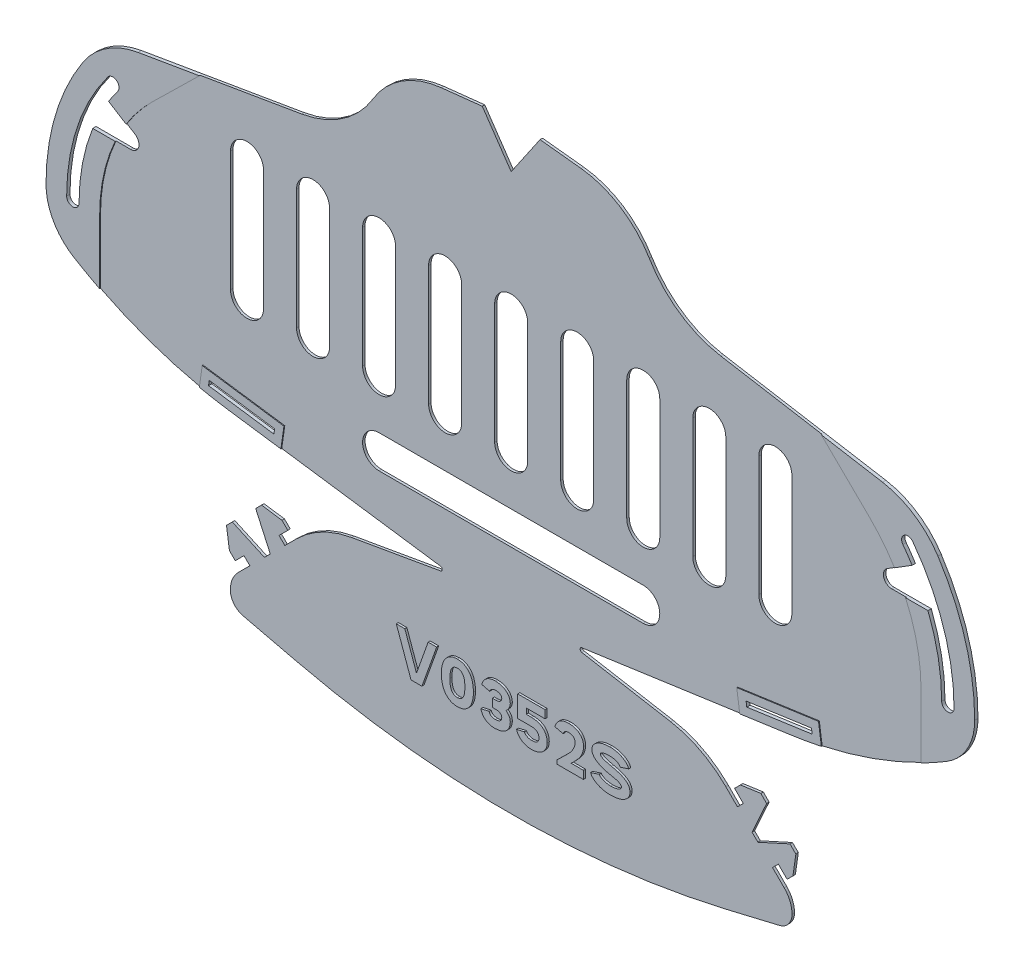
from build123d import *

# Parameters (mm, degrees)
MAIN_SHAPE_DEPTH                   = 0.6
ELASTIC_ATTACHMENT_POINTS_DEPTH    = 184.525502315
REINFORCED_ATTACHMENT_POINTS_DEPTH = 0.2
TAB_SLITS_DEPTH                    = 184.525502315
REINFORCED_TAB_SLITS_DEPTH         = 0.2
TAB_FLEX_RELIEF_DEPTH              = 184.525502315
TAB_FLEX_RELIEF_DEPTH_BACK         = 184.525502315
BREATHING_SLITS_DEPTH              = 184.525502315
VERSION_NUMBER_DEPTH               = 0.5
FILLET1_R                          = 0.5
CUT_EXTRUDE1_DEPTH                 = 184.526265229
CUT_EXTRUDE1_DEPTH_BACK            = 184.526265229


with BuildPart() as part:
    # Sketch1 → Main Shape (new body)
    with BuildSketch(Plane.XY):
        with BuildLine():
            Line((0, -10.235233266), (-7, 0))
            Line((-7, 0), (-16.941855461, -1.076805455))
            ThreePointArc((-16.941855461, -1.076805455), (-26.448172688, -4.42923559), (-33.461443341, -11.669600897))
            ThreePointArc((-33.461443341, -11.669600897), (-40.804108255, -19.481824954), (-50.74391922, -23.5))
            Line((-50.74391922, -23.5), (-90.180351554, -30.190874742))
            ThreePointArc((-90.180351554, -30.190874742), (-97.811505455, -33.190405434), (-103.597722286, -39))
            ThreePointArc((-103.597722286, -39), (-110.227482046, -53.35351039), (-112.5, -69))
            ThreePointArc((-112.5, -69), (-110.685143325, -75.893640703), (-105.711102551, -81))
            ThreePointArc((-105.711102551, -81), (-87.655491519, -89.524485559), (-68.266232563, -94.291935705))
            Line((-68.266232563, -94.291935705), (-14, -102))
            Line((-14, -102), (-38.626554922, -106.304973016))
            ThreePointArc((-38.626554922, -106.304973016), (-45.849449199, -108.748014338), (-52, -113.254607005))
            Line((-52, -113.254607005), (-54.828307349, -116.0831539))
            Line((-54.828307349, -116.0831539), (-56.242580797, -114.669000226))
            Line((-56.242580797, -114.669000226), (-54.121350285, -112.547590054))
            Line((-54.121350285, -112.547590054), (-55.535623732, -111.13343638))
            Line((-55.535623732, -111.13343638), (-60.48540114, -110.426539202))
            Line((-60.48540114, -110.426539202), (-68.970323187, -118.912179887))
            Line((-68.970323187, -118.912179887), (-68.263006804, -123.861897408))
            Line((-68.263006804, -123.861897408), (-66.848733357, -125.276051082))
            Line((-66.848733357, -125.276051082), (-64.727502845, -123.154640911))
            Line((-64.727502845, -123.154640911), (-63.313229397, -124.568794586))
            Line((-63.313229397, -124.568794586), (-66.141536747, -127.397341481))
            ThreePointArc((-66.141536747, -127.397341481), (-67.550417669, -129.506025763), (-68.045148042, -131.993340924))
            ThreePointArc((-68.045148042, -131.993340924), (-67.183295285, -134.473669911), (-64.9691321, -135.885159709))
            Line((-64.9691321, -135.885159709), (-52.436095294, -138.860716087))
            ThreePointArc((-52.436095294, -138.860716087), (-26.397134772, -143.459954927), (0, -145))
            ThreePointArc((0, -145), (26.397134772, -143.459954927), (52.436095294, -138.860716087))
            Line((52.436095294, -138.860716087), (64.9691321, -135.885159709))
            ThreePointArc((64.9691321, -135.885159709), (67.183295285, -134.473669911), (68.045148042, -131.993340924))
            ThreePointArc((68.045148042, -131.993340924), (67.550417669, -129.506025763), (66.141536747, -127.397341481))
            Line((66.141536747, -127.397341481), (63.313229397, -124.568794586))
            Line((63.313229397, -124.568794586), (64.727502845, -123.154640911))
            Line((64.727502845, -123.154640911), (66.848733357, -125.276051082))
            Line((66.848733357, -125.276051082), (68.263006804, -123.861897408))
            Line((68.263006804, -123.861897408), (68.970323187, -118.912179887))
            Line((68.970323187, -118.912179887), (60.48540114, -110.426539202))
            Line((60.48540114, -110.426539202), (55.535623732, -111.13343638))
            Line((55.535623732, -111.13343638), (54.121350285, -112.547590054))
            Line((54.121350285, -112.547590054), (56.242580797, -114.669000226))
            Line((56.242580797, -114.669000226), (54.828307349, -116.0831539))
            Line((54.828307349, -116.0831539), (52, -113.254607005))
            ThreePointArc((52, -113.254607005), (45.849449199, -108.748014338), (38.626554922, -106.304973016))
            Line((38.626554922, -106.304973016), (14, -102))
            Line((14, -102), (68.266232563, -94.291935705))
            ThreePointArc((68.266232563, -94.291935705), (87.655491519, -89.524485559), (105.711102551, -81))
            ThreePointArc((105.711102551, -81), (110.685143325, -75.893640703), (112.5, -69))
            ThreePointArc((112.5, -69), (110.227482046, -53.35351039), (103.597722286, -39))
            ThreePointArc((103.597722286, -39), (97.811505455, -33.190405434), (90.180351554, -30.190874742))
            Line((90.180351554, -30.190874742), (50.74391922, -23.5))
            ThreePointArc((50.74391922, -23.5), (40.804108255, -19.481824954), (33.461443341, -11.669600897))
            ThreePointArc((33.461443341, -11.669600897), (26.448172688, -4.42923559), (16.941855461, -1.076805455))
            Line((16.941855461, -1.076805455), (7, 0))
            Line((7, 0), (0, -10.235233266))
        make_face()
    extrude(amount=MAIN_SHAPE_DEPTH)

    # Sketch2 → Elastic Attachment Points (cut, through all)
    with BuildSketch(Plane.XY.offset(0.6)):
        with BuildLine():
            ThreePointArc((-97.5, -39), (-104.934164903, -53.188611699), (-107.5, -69))
            ThreePointArc((-107.5, -69), (-106, -70.5), (-104.5, -69))
            ThreePointArc((-104.5, -69), (-102.088115008, -54.137294997), (-95.1, -40.8))
            ThreePointArc((-95.1, -40.8), (-95.4, -38.7), (-97.5, -39))
        make_face()
        with BuildLine():
            ThreePointArc((97.5, -39), (104.934164903, -53.188611699), (107.5, -69))
            ThreePointArc((107.5, -69), (106, -70.5), (104.5, -69))
            ThreePointArc((104.5, -69), (102.088115008, -54.137294997), (95.1, -40.8))
            ThreePointArc((95.1, -40.8), (95.4, -38.7), (97.5, -39))
        make_face()
    extrude(amount=-ELASTIC_ATTACHMENT_POINTS_DEPTH, mode=Mode.SUBTRACT)

    # Sketch7 → Reinforced Attachment Points (add)
    # profile 1 of 2: a face of its own
    with BuildSketch(Plane.XY.offset(0.6)):
        with BuildLine():
            Line((-99.5, -69), (-99.5, -84.438405623))
            ThreePointArc((-99.5, -84.438405623), (-102.636073846, -82.774338486), (-105.711102551, -81))
            ThreePointArc((-105.711102551, -81), (-110.685143325, -75.893640703), (-112.5, -69))
            ThreePointArc((-112.5, -69), (-110.227482046, -53.35351039), (-103.597722286, -39))
            ThreePointArc((-103.597722286, -39), (-97.811505455, -33.190405434), (-90.180351554, -30.190874742))
            Line((-90.180351554, -30.190874742), (-75.331937335, -27.671659038))
            Line((-75.331937335, -27.671659038), (-86.893876913, -39))
            ThreePointArc((-86.893876913, -39), (-96.22042633, -52.729517991), (-99.5, -69))
        make_face()
        with BuildLine():
            ThreePointArc((-107.5, -69), (-106, -70.5), (-104.5, -69))
            ThreePointArc((-104.5, -69), (-102.088115008, -54.137294997), (-95.1, -40.8))
            ThreePointArc((-95.1, -40.8), (-95.4, -38.7), (-97.5, -39))
            ThreePointArc((-97.5, -39), (-104.934164903, -53.188611699), (-107.5, -69))
        make_face(mode=Mode.SUBTRACT)
    # profile 2 of 2: a face of its own
    with BuildSketch(Plane.XY.offset(0.6)):
        with BuildLine():
            Line((75.331937335, -27.671659038), (90.180351554, -30.190874742))
            ThreePointArc((90.180351554, -30.190874742), (97.811505455, -33.190405434), (103.597722286, -39))
            ThreePointArc((103.597722286, -39), (110.227482046, -53.35351039), (112.5, -69))
            ThreePointArc((112.5, -69), (110.685143325, -75.893640703), (105.711102551, -81))
            ThreePointArc((105.711102551, -81), (102.636073846, -82.774338486), (99.5, -84.438405623))
            Line((99.5, -84.438405623), (99.5, -69))
            ThreePointArc((99.5, -69), (96.22042633, -52.729517991), (86.893876913, -39))
            Line((86.893876913, -39), (75.331937335, -27.671659038))
        make_face()
        with BuildLine():
            ThreePointArc((104.5, -69), (106, -70.5), (107.5, -69))
            ThreePointArc((107.5, -69), (104.934164903, -53.188611699), (97.5, -39))
            ThreePointArc((97.5, -39), (95.4, -38.7), (95.1, -40.8))
            ThreePointArc((95.1, -40.8), (102.088115008, -54.137294997), (104.5, -69))
        make_face(mode=Mode.SUBTRACT)
    extrude(amount=REINFORCED_ATTACHMENT_POINTS_DEPTH)

    # Sketch6 → Tab Slits (cut, through all)
    with BuildSketch(Plane.XY.offset(0.6)):
        Polygon((-73.122472744, -91.582072346), (-57.281477317, -93.832153206), (-57.112721253, -92.644078549), (-72.95371668, -90.393997689), align=None)
        Polygon((73.122472744, -91.582072346), (72.95371668, -90.393997689), (57.112721253, -92.644078549), (57.281477317, -93.832153206), align=None)
    extrude(amount=-TAB_SLITS_DEPTH, mode=Mode.SUBTRACT)

    # Sketch9 → Reinforced Tab Slits (add)
    # profile 1 of 2: a face of its own
    with BuildSketch(Plane.XY.offset(0.6)):
        with BuildLine():
            Line((-55.582612996, -96.093537742), (-54.851336717, -90.945214228))
            Line((-54.851336717, -90.945214228), (-74.652581001, -88.132613153))
            Line((-74.652581001, -88.132613153), (-75.347469499, -93.024759795))
            ThreePointArc((-75.347469499, -93.024759795), (-71.81824936, -93.72204393), (-68.266232563, -94.291935705))
            Line((-68.266232563, -94.291935705), (-55.582612996, -96.093537742))
        make_face()
        Polygon((-57.281477317, -93.832153206), (-57.112721253, -92.644078549), (-72.95371668, -90.393997689), (-73.122472744, -91.582072346), align=None, mode=Mode.SUBTRACT)
    # profile 2 of 2: a face of its own
    with BuildSketch(Plane.XY.offset(0.6)):
        with BuildLine():
            Line((68.266232563, -94.291935705), (55.582612996, -96.093537742))
            Line((55.582612996, -96.093537742), (54.851336717, -90.945214228))
            Line((54.851336717, -90.945214228), (74.652581001, -88.132613153))
            Line((74.652581001, -88.132613153), (75.347469499, -93.024759795))
            ThreePointArc((75.347469499, -93.024759795), (71.81824936, -93.72204393), (68.266232563, -94.291935705))
        make_face()
        Polygon((57.112721253, -92.644078549), (72.95371668, -90.393997689), (73.122472744, -91.582072346), (57.281477317, -93.832153206), align=None, mode=Mode.SUBTRACT)
    extrude(amount=REINFORCED_TAB_SLITS_DEPTH)

    # Sketch11 → Tab Flex Relief (cut, two sides: drawn at the far end of the back side and taken through both)
    with BuildSketch(Plane.XY.offset(0.6).offset(-TAB_FLEX_RELIEF_DEPTH_BACK)):
        Polygon((-67.556169513, -117.49790644), (-59.777845211, -121.033110967), (-58.363691536, -119.618837519), (-61.899554814, -111.840812649), align=None)
        Polygon((61.899554814, -111.840812649), (67.556169513, -117.49790644), (59.777845211, -121.033110967), (58.363691536, -119.618837519), align=None)
    extrude(amount=TAB_FLEX_RELIEF_DEPTH + TAB_FLEX_RELIEF_DEPTH_BACK, mode=Mode.SUBTRACT)

    # Sketch3 → Breathing Slits (cut, through all)
    with BuildSketch(Plane.XY.offset(0.6)):
        with BuildLine():
            Line((4, -39.9), (4, -69))
            ThreePointArc((4, -69), (0, -73), (-4, -69))
            Line((-4, -69), (-4, -39.9))
            ThreePointArc((-4, -39.9), (0, -35.9), (4, -39.9))
        make_face()
        with BuildLine():
            Line((-12, -39.9), (-12, -69))
            ThreePointArc((-12, -69), (-16, -73), (-20, -69))
            Line((-20, -69), (-20, -39.9))
            ThreePointArc((-20, -39.9), (-16, -35.9), (-12, -39.9))
        make_face()
        with BuildLine():
            Line((-28, -39.9), (-28, -69))
            ThreePointArc((-28, -69), (-32, -73), (-36, -69))
            Line((-36, -69), (-36, -39.9))
            ThreePointArc((-36, -39.9), (-32, -35.9), (-28, -39.9))
        make_face()
        with BuildLine():
            Line((-32, -81), (32, -81))
            ThreePointArc((32, -81), (36, -85), (32, -89))
            Line((32, -89), (-32, -89))
            ThreePointArc((-32, -89), (-36, -85), (-32, -81))
        make_face()
        with BuildLine():
            Line((-44, -39.9), (-44, -69))
            ThreePointArc((-44, -69), (-48, -73), (-52, -69))
            Line((-52, -69), (-52, -39.9))
            ThreePointArc((-52, -39.9), (-48, -35.9), (-44, -39.9))
        make_face()
        with BuildLine():
            Line((-60, -39.9), (-60, -69))
            ThreePointArc((-60, -69), (-64, -73), (-68, -69))
            Line((-68, -69), (-68, -39.9))
            ThreePointArc((-68, -39.9), (-64, -35.9), (-60, -39.9))
        make_face()
        with BuildLine():
            Line((12, -39.9), (12, -69))
            ThreePointArc((12, -69), (16, -73), (20, -69))
            Line((20, -69), (20, -39.9))
            ThreePointArc((20, -39.9), (16, -35.9), (12, -39.9))
        make_face()
        with BuildLine():
            Line((28, -39.9), (28, -69))
            ThreePointArc((28, -69), (32, -73), (36, -69))
            Line((36, -69), (36, -39.9))
            ThreePointArc((36, -39.9), (32, -35.9), (28, -39.9))
        make_face()
        with BuildLine():
            Line((44, -39.9), (44, -69))
            ThreePointArc((44, -69), (48, -73), (52, -69))
            Line((52, -69), (52, -39.9))
            ThreePointArc((52, -39.9), (48, -35.9), (44, -39.9))
        make_face()
        with BuildLine():
            Line((60, -39.9), (60, -69))
            ThreePointArc((60, -69), (64, -73), (68, -69))
            Line((68, -69), (68, -39.9))
            ThreePointArc((68, -39.9), (64, -35.9), (60, -39.9))
        make_face()
    extrude(amount=-BREATHING_SLITS_DEPTH, mode=Mode.SUBTRACT)

    # Sketch8 → Version Number (add)
    # profile 1 of 6: a face of its own
    with BuildSketch(Plane.XY.offset(0.6)):
        Polygon((-23.759119471, -128.5), (-21.124198837, -128.5), (-17.552770265, -118.5), (-19.616262329, -118.5), (-22.441659154, -126.420634921), (-25.267055979, -118.5), (-27.330548043, -118.5), align=None)
    # profile 2 of 6: a face of its own
    with BuildSketch(Plane.XY.offset(0.6)):
        with BuildLine():
            add(Edge.make_bspline(
                [(-12.530595586, -118.5), (-12.674961549, -118.505695671), (-12.957716697, -118.51685121), (-13.370851698, -118.5745591), (-13.758694402, -118.680335178), (-14.125895977, -118.819656178), (-14.468171549, -119.003303471), (-14.791964723, -119.221085059), (-15.084975338, -119.487440084), (-15.360430391, -119.785519386), (-15.606293572, -120.12453761), (-15.819729282, -120.500892889), (-16.001692058, -120.912503383), (-16.150613222, -121.360169436), (-16.26616227, -121.844506854), (-16.353916209, -122.364485904), (-16.405470648, -122.921030718), (-16.416127378, -123.303893775), (-16.42160596, -123.500722112)],
                knots=[0, 0, 0, 0, 0.970159994, 1.900155169, 2.79438565, 3.665191596, 4.532301255, 5.397946305, 6.279238358, 7.185391655, 8.120220805, 9.085107467, 10.08639026, 11.138349125, 12.249459105, 13.427760297, 14.677622047, 16, 16, 16, 16], degree=3))
            add(Edge.make_bspline(
                [(-16.42160596, -123.500722112), (-16.416182569, -123.69832053), (-16.405673943, -124.081196856), (-16.353706873, -124.637697099), (-16.266260983, -125.156966907), (-16.150151127, -125.641884177), (-16.002208463, -126.090648826), (-15.819661838, -126.502814664), (-15.606351534, -126.879260377), (-15.360270354, -127.218032326), (-15.085878616, -127.51659595), (-14.79041107, -127.779877259), (-14.469059828, -128.000979952), (-14.125702523, -128.183632701), (-13.759149468, -128.324409639), (-13.370196389, -128.425104033), (-12.958418069, -128.488808035), (-12.675636695, -128.496221224), (-12.53149262, -128.5)],
                knots=[0, 0, 0, 0, 1.327400251, 2.57203543, 3.750234214, 4.861247624, 5.917991082, 6.919186852, 7.883989653, 8.818737555, 9.724812096, 10.602616666, 11.47109776, 12.338132057, 13.208862319, 14.101698703, 15.032365954, 16, 16, 16, 16], degree=3))
            add(Edge.make_bspline(
                [(-12.53149262, -128.5), (-12.387352951, -128.496210687), (-12.104580221, -128.488776824), (-11.692739807, -128.425221319), (-11.303317476, -128.323813307), (-10.935955998, -128.184839888), (-10.593566519, -128.000200623), (-10.272520113, -127.779984633), (-9.977121444, -127.516566079), (-9.702711644, -127.218040576), (-9.456631017, -126.879258594), (-9.243338275, -126.502813072), (-9.060716398, -126.090657611), (-8.91307866, -125.641847927), (-8.79576581, -125.157235462), (-8.713323664, -124.637275213), (-8.655667439, -124.081441513), (-8.64775707, -123.698369528), (-8.643675686, -123.500722112)],
                knots=[0, 0, 0, 0, 0.96765053, 1.898333634, 2.791185227, 3.666728435, 4.529238626, 5.397734515, 6.275554038, 7.181644014, 8.116407839, 9.081227075, 10.082439899, 11.139201358, 12.250233695, 13.427610983, 14.672766316, 16, 16, 16, 16], degree=3))
            add(Edge.make_bspline(
                [(-8.643675686, -123.500722112), (-8.647816516, -123.303845261), (-8.655873221, -122.920787111), (-8.7131172, -122.364907693), (-8.795865394, -121.844238468), (-8.91261503, -121.360205444), (-9.061232995, -120.912494629), (-9.243270813, -120.500894477), (-9.45668899, -120.124539393), (-9.702551584, -119.785511139), (-9.978024821, -119.487469991), (-10.270966029, -119.220977415), (-10.594450892, -119.004075275), (-10.935762539, -118.818455332), (-11.303773103, -118.680915067), (-11.692089735, -118.574534625), (-12.104938813, -118.516562336), (-12.387423644, -118.506550382), (-12.53149262, -118.501444225)],
                knots=[0, 0, 0, 0, 1.322391154, 2.572941942, 3.750582404, 4.861863084, 5.913983562, 6.915420183, 7.880455081, 8.815427849, 9.721720359, 10.603147806, 11.468925845, 12.331628829, 13.207367743, 14.101735605, 15.031873656, 16, 16, 16, 16], degree=3))
            Line((-12.53149262, -118.501444225), (-12.530595586, -118.5))
        make_face()
        with BuildLine():
            add(Edge.make_bspline(
                [(-12.530595586, -126.579365079), (-12.599915134, -126.580142247), (-12.735925459, -126.581667111), (-12.933378696, -126.549518886), (-13.119829791, -126.50001124), (-13.294007086, -126.424863461), (-13.457802447, -126.32888552), (-13.60841799, -126.207295998), (-13.746777014, -126.063513987), (-13.874092072, -125.896932623), (-13.987963374, -125.703005633), (-14.086494363, -125.478827118), (-14.167231778, -125.222713054), (-14.236408536, -124.937433189), (-14.287659901, -124.621763618), (-14.326163466, -124.276117752), (-14.35203013, -123.899148475), (-14.355389405, -123.63702081), (-14.357136129, -123.500722112)],
                knots=[0, 0, 0, 0, 0.820209436, 1.609314487, 2.362064528, 3.101854642, 3.850272983, 4.605479342, 5.3882482, 6.210255141, 7.084711649, 8.047345167, 9.106040688, 10.263495908, 11.523832392, 12.893430008, 14.384674726, 16, 16, 16, 16], degree=3))
            add(Edge.make_bspline(
                [(-14.357136129, -123.500722112), (-14.355382518, -123.364424703), (-14.352009999, -123.102299516), (-14.326234355, -122.725313211), (-14.28734138, -122.378974061), (-14.237045096, -122.063111109), (-14.166827673, -121.778059679), (-14.086524642, -121.522619394), (-13.987994481, -121.298401339), (-13.873959822, -121.104640769), (-13.747569518, -120.937923887), (-13.607607032, -120.796456824), (-13.457886281, -120.674830172), (-13.294046396, -120.578630118), (-13.119400376, -120.50465551), (-12.934032829, -120.450210023), (-12.735889121, -120.423926373), (-12.600445848, -120.422146526), (-12.53149262, -120.421240419)],
                knots=[0, 0, 0, 0, 1.616177311, 3.108208617, 4.478528655, 5.748482895, 6.897727805, 7.956981757, 8.920123036, 9.795040793, 10.617481319, 11.394165711, 12.149770419, 12.898583529, 13.63876386, 14.394368568, 15.182584207, 16, 16, 16, 16], degree=3))
            add(Edge.make_bspline(
                [(-12.53149262, -120.421240419), (-12.462540984, -120.422149219), (-12.32710084, -120.423934355), (-12.12893462, -120.450179948), (-11.943648032, -120.504762296), (-11.769314685, -120.577982734), (-11.60708935, -120.675595023), (-11.457619592, -120.796360516), (-11.317719345, -120.937948802), (-11.191355033, -121.104645093), (-11.077130296, -121.298351736), (-10.979345015, -121.523063414), (-10.895385157, -121.777554553), (-10.826196058, -122.063195246), (-10.77556638, -122.378948588), (-10.736774265, -122.725320897), (-10.710968601, -123.102297333), (-10.70760045, -123.364423957), (-10.70584911, -123.500722112)],
                knots=[0, 0, 0, 0, 0.817669415, 1.606129616, 2.361968767, 3.102378757, 3.843623451, 4.599462602, 5.376387978, 6.199083685, 7.074272906, 8.037713021, 9.100132017, 10.249733507, 11.520081779, 12.89082699, 14.383321233, 16, 16, 16, 16], degree=3))
            add(Edge.make_bspline(
                [(-10.70584911, -123.500722112), (-10.707593564, -123.637021556), (-10.710948472, -123.899150658), (-10.736845147, -124.276110066), (-10.775248097, -124.621789015), (-10.826831316, -124.937349474), (-10.894973181, -125.223220708), (-10.979374693, -125.478383327), (-11.077161548, -125.703055181), (-11.191222727, -125.896928348), (-11.31851187, -126.063488884), (-11.45680796, -126.207393621), (-11.607172049, -126.328120602), (-11.769353276, -126.425517476), (-11.943218527, -126.499891817), (-12.129587864, -126.549600883), (-12.326777493, -126.581404352), (-12.462476029, -126.580608552), (-12.53149262, -126.580203806)],
                knots=[0, 0, 0, 0, 1.616177474, 3.108208932, 4.478529109, 5.739530511, 6.897596372, 7.959685938, 8.922827315, 9.797745161, 10.620185771, 11.403367596, 12.15897238, 12.899987232, 13.640167639, 14.39331481, 15.182836171, 16, 16, 16, 16], degree=3))
            Line((-12.53149262, -126.580203806), (-12.530595586, -126.579365079))
        make_face(mode=Mode.SUBTRACT)
    # profile 3 of 6: a face of its own
    with BuildSketch(Plane.XY.offset(0.6)):
        with BuildLine():
            Line((-3.207990778, -124.404761905), (-3.112752683, -124.404761905))
            add(Edge.make_bspline(
                [(-3.112752683, -124.404761905), (-3.012484788, -124.411299477), (-2.821849587, -124.423729091), (-2.55518329, -124.486416557), (-2.322389201, -124.578961335), (-2.130701824, -124.709274647), (-1.977056522, -124.861365804), (-1.862729083, -125.032278467), (-1.793067839, -125.222537651), (-1.784192402, -125.355662585), (-1.779715371, -125.422814713)],
                knots=[0, 0, 0, 0, 1.293250512, 2.458803691, 3.516087315, 4.504014474, 5.424976382, 6.287022232, 7.135923681, 8, 8, 8, 8], degree=3))
            add(Edge.make_bspline(
                [(-1.779715371, -125.422814713), (-1.783004921, -125.504440638), (-1.789365907, -125.662280257), (-1.858513279, -125.887718235), (-1.976868137, -126.087113891), (-2.111783973, -126.23073656), (-2.240948629, -126.331172702), (-2.355837625, -126.395688771), (-2.484688524, -126.450185226), (-2.62771653, -126.49595932), (-2.784437989, -126.532200484), (-2.955396926, -126.560253509), (-3.141220649, -126.575366879), (-3.270059645, -126.5785552), (-3.33667927, -126.580203806)],
                knots=[0, 0, 0, 0, 1.334208421, 2.579951764, 3.816761299, 5.103436918, 5.78324123, 6.491044783, 7.25516555, 8.072210043, 8.94833879, 9.888551629, 10.908219533, 12, 12, 12, 12], degree=3))
            add(Edge.make_bspline(
                [(-3.33667927, -126.580203806), (-3.411072861, -126.579024673), (-3.561557454, -126.576639503), (-3.788204, -126.537785365), (-4.016478958, -126.472292557), (-4.243576357, -126.384048723), (-4.457732958, -126.26078738), (-4.635055487, -126.088542309), (-4.776225242, -125.87591894), (-4.830794397, -125.712337396), (-4.859197065, -125.62719493)],
                knots=[0, 0, 0, 0, 0.920255672, 1.861508472, 2.836752399, 3.857684402, 4.873720033, 5.872631744, 6.892727297, 8, 8, 8, 8], degree=3))
            Line((-4.859197065, -125.62719493), (-6.842911413, -126.071428571))
            add(Edge.make_bspline(
                [(-6.842911413, -126.071428571), (-6.820076129, -126.160336196), (-6.775119984, -126.335369884), (-6.682111105, -126.586847228), (-6.570673667, -126.824009097), (-6.445517324, -127.050933458), (-6.297366237, -127.26169635), (-6.133197698, -127.459934114), (-5.953966168, -127.647890635), (-5.753633876, -127.819546753), (-5.536186898, -127.976110236), (-5.299040324, -128.112422888), (-5.044474826, -128.230322428), (-4.768937437, -128.322934743), (-4.476819821, -128.399729339), (-4.165551252, -128.45295857), (-3.836720273, -128.491934936), (-3.610838781, -128.497268097), (-3.495131348, -128.5)],
                knots=[0, 0, 0, 0, 0.97897001, 1.927311989, 2.855460552, 3.773345826, 4.68872018, 5.599601379, 6.518067916, 7.456260856, 8.41049365, 9.372940738, 10.370680865, 11.39871829, 12.470472684, 13.590411754, 14.765692276, 16, 16, 16, 16], degree=3))
            add(Edge.make_bspline(
                [(-3.495131348, -128.5), (-3.338861462, -128.494245394), (-3.036335412, -128.483104934), (-2.598526623, -128.435865678), (-2.192878241, -128.358387224), (-1.819103449, -128.252017359), (-1.474229756, -128.123277608), (-1.163244335, -127.961059217), (-0.8811529, -127.774497038), (-0.633498878, -127.55815064), (-0.419104165, -127.319870658), (-0.227346591, -127.071551477), (-0.0695573, -126.805353082), (0.062973354, -126.527874631), (0.161600978, -126.234513517), (0.233064682, -125.928607165), (0.274737083, -125.607680152), (0.279854717, -125.38925418), (0.282458052, -125.278141077)],
                knots=[0, 0, 0, 0, 1.338573179, 2.591371041, 3.766159492, 4.869841347, 5.915366975, 6.911991706, 7.866279139, 8.804635322, 9.718527085, 10.607232931, 11.486170613, 12.362759498, 13.235296616, 14.130311397, 15.048891017, 16, 16, 16, 16], degree=3))
            add(Edge.make_bspline(
                [(0.282458052, -125.278141077), (0.277109626, -125.181448476), (0.266582866, -124.991138356), (0.211267281, -124.713321084), (0.118907393, -124.451246621), (-0.010284346, -124.20784025), (-0.161484051, -123.977552327), (-0.336615467, -123.764837772), (-0.531012513, -123.566155092), (-0.675437179, -123.449574998), (-0.748628659, -123.39049458)],
                knots=[0, 0, 0, 0, 1.042147361, 2.051151675, 3.039496243, 4.024119517, 5.012016893, 6.002285516, 6.987598979, 8, 8, 8, 8], degree=3))
            add(Edge.make_bspline(
                [(-0.748628659, -123.39049458), (-0.675447625, -123.325162044), (-0.531086868, -123.19628365), (-0.336814746, -122.981710509), (-0.16264404, -122.755542958), (-0.009288288, -122.515248899), (0.117913236, -122.261642739), (0.210737326, -121.993228321), (0.266645589, -121.711764564), (0.277130976, -121.519933272), (0.282458052, -121.42247384)],
                knots=[0, 0, 0, 0, 1.026734164, 2.025389794, 3.025877614, 4.013273499, 5.006315215, 5.989929209, 6.978788314, 8, 8, 8, 8], degree=3))
            add(Edge.make_bspline(
                [(0.282458052, -121.42247384), (0.278376187, -121.322020203), (0.270357208, -121.124675201), (0.223414511, -120.835115028), (0.148236496, -120.558271626), (0.040794439, -120.294880847), (-0.092621157, -120.042407113), (-0.257433071, -119.803370965), (-0.448462249, -119.574583887), (-0.669293108, -119.361344215), (-0.915992266, -119.166999953), (-1.187800483, -118.995833154), (-1.482339172, -118.84746887), (-1.803115225, -118.730513446), (-2.145030842, -118.632405283), (-2.510910678, -118.562780212), (-2.899985833, -118.515976725), (-3.167373924, -118.506371293), (-3.304529573, -118.501444225)],
                knots=[0, 0, 0, 0, 0.933249724, 1.833404674, 2.71837752, 3.592513965, 4.4704886, 5.365912677, 6.284554944, 7.234984132, 8.212272519, 9.196674926, 10.214289296, 11.269589965, 12.363543901, 13.515449053, 14.72555956, 16, 16, 16, 16], degree=3))
            add(Edge.make_bspline(
                [(-3.304529573, -118.501444225), (-3.417921925, -118.504384419), (-3.639102684, -118.510119502), (-3.961886954, -118.546209564), (-4.267716259, -118.597359567), (-4.556534985, -118.671164203), (-4.827578542, -118.76520159), (-5.081300625, -118.877770477), (-5.317830159, -119.009217236), (-5.535433429, -119.161041577), (-5.735694004, -119.328960798), (-5.917090992, -119.510905494), (-6.081837986, -119.704452098), (-6.226372162, -119.91288512), (-6.356001637, -120.132286581), (-6.462536666, -120.36651166), (-6.557455625, -120.610059019), (-6.600859843, -120.780460499), (-6.622837588, -120.866743363)],
                knots=[0, 0, 0, 0, 1.229240767, 2.397731417, 3.51786287, 4.588673614, 5.625367482, 6.624717489, 7.594406979, 8.554388623, 9.496885304, 10.424058211, 11.336820069, 12.248524965, 13.170856983, 14.095351914, 15.035580601, 16, 16, 16, 16], degree=3))
            Line((-6.622837588, -120.866743363), (-4.715927286, -121.373015873))
            add(Edge.make_bspline(
                [(-4.715927286, -121.373015873), (-4.704629636, -121.326631527), (-4.680113461, -121.22597637), (-4.589612333, -121.081457089), (-4.467763659, -120.927147787), (-4.306550884, -120.771324055), (-4.109173111, -120.625559671), (-3.871083133, -120.514206488), (-3.597998746, -120.446844288), (-3.405169309, -120.430020784), (-3.304529573, -120.421240419)],
                knots=[0, 0, 0, 0, 0.626586808, 1.359708585, 2.222843852, 3.223153095, 4.308434095, 5.447412619, 6.667777482, 8, 8, 8, 8], degree=3))
            add(Edge.make_bspline(
                [(-3.304529573, -120.421240419), (-3.232496587, -120.423218633), (-3.094261098, -120.42701494), (-2.896857776, -120.449676308), (-2.716566149, -120.474391788), (-2.555516743, -120.515621967), (-2.409901736, -120.558109891), (-2.28529255, -120.618078056), (-2.174531215, -120.680273756), (-2.059627527, -120.780934624), (-1.945299536, -120.912654377), (-1.842305584, -121.077310889), (-1.782308569, -121.24921056), (-1.780569501, -121.365405566), (-1.779715371, -121.42247384)],
                knots=[0, 0, 0, 0, 1.26888152, 2.435057415, 3.499383416, 4.470882074, 5.362320585, 6.164854387, 6.902680001, 7.591682225, 8.843898063, 9.963361673, 10.999720905, 12, 12, 12, 12], degree=3))
            add(Edge.make_bspline(
                [(-1.779715371, -121.42247384), (-1.784786125, -121.49199044), (-1.794864324, -121.630155711), (-1.870143136, -121.827940252), (-1.991668449, -122.008163808), (-2.154995196, -122.171288708), (-2.362331104, -122.307565764), (-2.609868079, -122.408872593), (-2.896748413, -122.47003825), (-3.100603256, -122.480300003), (-3.208080482, -122.485710249)],
                knots=[0, 0, 0, 0, 0.842573162, 1.674626639, 2.532888499, 3.465967991, 4.458251597, 5.524776888, 6.695002246, 8, 8, 8, 8], degree=3))
            Line((-3.208080482, -122.485710249), (-4.065133636, -122.484126984))
            Line((-4.065133636, -122.484126984), (-4.065133636, -124.404761905))
            Line((-4.065133636, -124.404761905), (-3.207990778, -124.404761905))
        make_face()
    # profile 4 of 6: a face of its own
    with BuildSketch(Plane.XY.offset(0.6)):
        with BuildLine():
            Line((5.439721561, -121.753968254), (4.154007275, -121.753968254))
            Line((4.154007275, -121.753968254), (4.154007275, -120.420634921))
            Line((4.154007275, -120.420634921), (8.693689815, -120.420634921))
            Line((8.693689815, -120.420634921), (8.693689815, -118.5))
            Line((8.693689815, -118.5), (2.090515211, -118.5))
            Line((2.090515211, -118.5), (2.090515211, -123.674603175))
            Line((2.090515211, -123.674603175), (5.360356481, -123.674603175))
            add(Edge.make_bspline(
                [(5.360356481, -123.674603175), (5.43444583, -123.675602086), (5.578397866, -123.677542922), (5.787844491, -123.692704514), (5.983362538, -123.723042675), (6.164886057, -123.763288516), (6.331986377, -123.817251662), (6.486574317, -123.879484934), (6.624192692, -123.959553064), (6.751572633, -124.046197885), (6.860456023, -124.149968295), (6.956599069, -124.26484275), (7.039622666, -124.390602025), (7.105985016, -124.530129867), (7.158972933, -124.680251755), (7.19787934, -124.842608973), (7.223224328, -125.017132432), (7.228615427, -125.137973815), (7.231385424, -125.200063241)],
                knots=[0, 0, 0, 0, 1.291340122, 2.50901164, 3.656233385, 4.737231688, 5.745647761, 6.71445312, 7.634539433, 8.515488686, 9.393300537, 10.245701923, 11.122702301, 12.011797026, 12.93168986, 13.892747604, 14.917274139, 16, 16, 16, 16], degree=3))
            add(Edge.make_bspline(
                [(7.231385424, -125.200063241), (7.227173073, -125.300114528), (7.219088802, -125.492131264), (7.138823222, -125.765733398), (6.999681727, -126.004538024), (6.841071336, -126.17434082), (6.689315161, -126.290319351), (6.557584416, -126.365431401), (6.412148997, -126.430026061), (6.251802635, -126.482096845), (6.078009165, -126.52675039), (5.887832523, -126.55439299), (5.684132949, -126.576932347), (5.542833101, -126.5790915), (5.470041308, -126.580203806)],
                knots=[0, 0, 0, 0, 1.417186054, 2.719839454, 3.999831516, 5.306419273, 5.988605249, 6.704054952, 7.452945314, 8.243009127, 9.093975494, 9.995834141, 10.967537284, 12, 12, 12, 12], degree=3))
            add(Edge.make_bspline(
                [(5.470041308, -126.580203806), (5.361133281, -126.574841975), (5.150468973, -126.564470411), (4.845518757, -126.511605126), (4.563645748, -126.424404763), (4.309388508, -126.306180725), (4.088303114, -126.167710506), (3.916459302, -126.007163051), (3.784811836, -125.83604344), (3.744358762, -125.706158133), (3.724772041, -125.643269778)],
                knots=[0, 0, 0, 0, 1.239808568, 2.398201666, 3.511107812, 4.586578273, 5.581900341, 6.46310827, 7.255862013, 8, 8, 8, 8], degree=3))
            Line((3.724772041, -125.643269778), (1.804800926, -126.071428571))
            add(Edge.make_bspline(
                [(1.804800926, -126.071428571), (1.828870785, -126.160548359), (1.87650127, -126.336902466), (1.982575417, -126.587616399), (2.107134443, -126.825640703), (2.25163892, -127.052018478), (2.420419016, -127.263372267), (2.610253483, -127.462365132), (2.821738641, -127.648069148), (3.053746964, -127.81997371), (3.30291766, -127.975914274), (3.569165844, -128.111508549), (3.848665069, -128.229596507), (4.145226539, -128.322648571), (4.454924968, -128.399168227), (4.780549711, -128.452814481), (5.120074541, -128.491742739), (5.352044721, -128.49721594), (5.470041308, -128.5)],
                knots=[0, 0, 0, 0, 0.933358014, 1.846969395, 2.747978179, 3.65058438, 4.560476191, 5.481090533, 6.430749403, 7.405393302, 8.400725728, 9.402100456, 10.426556211, 11.46786461, 12.544569044, 13.652675183, 14.805983081, 16, 16, 16, 16], degree=3))
            add(Edge.make_bspline(
                [(5.470041308, -128.5), (5.607247671, -128.495504774), (5.875682612, -128.486710171), (6.266772614, -128.433418982), (6.638657242, -128.360336182), (6.988191337, -128.252803179), (7.319485169, -128.123435212), (7.627328978, -127.960769192), (7.917422563, -127.774871052), (8.182689455, -127.558743904), (8.422054739, -127.321416343), (8.634662666, -127.067668109), (8.809926825, -126.794179288), (8.963161913, -126.509027952), (9.076267941, -126.203081966), (9.161876907, -125.88344012), (9.215513976, -125.5470022), (9.226131757, -125.31737072), (9.231555861, -125.200063241)],
                knots=[0, 0, 0, 0, 1.17826532, 2.30519616, 3.385644728, 4.42967802, 5.441717964, 6.435616201, 7.414838536, 8.396397341, 9.367976222, 10.306520034, 11.232826888, 12.153236024, 13.081197769, 14.026829533, 14.992003824, 16, 16, 16, 16], degree=3))
            add(Edge.make_bspline(
                [(9.231555861, -125.200063241), (9.227415016, -125.073635127), (9.219306914, -124.826078875), (9.173783777, -124.463686468), (9.095705061, -124.120728156), (8.987722759, -123.797399283), (8.849366532, -123.493469509), (8.67838428, -123.211065096), (8.479371855, -122.946164208), (8.249992533, -122.703396477), (7.991699282, -122.484022512), (7.705866415, -122.292954639), (7.392764203, -122.131495081), (7.053263601, -121.998507068), (6.687417764, -121.892820854), (6.294481375, -121.818407366), (5.875395367, -121.769392953), (5.586532834, -121.760188975), (5.437891611, -121.755452845)],
                knots=[0, 0, 0, 0, 1.047845617, 2.051764646, 3.021184748, 3.957929711, 4.871890627, 5.782411277, 6.68821354, 7.612570783, 8.544147221, 9.490634628, 10.455228194, 11.457623096, 12.507540162, 13.606000757, 14.768109627, 16, 16, 16, 16], degree=3))
            Line((5.437891611, -121.755452845), (5.439721561, -121.753968254))
        make_face()
    # profile 5 of 6: a face of its own
    with BuildSketch(Plane.XY.offset(0.6)):
        with BuildLine():
            Line((18.00806882, -126.579365079), (15.039814852, -126.579365079))
            Line((15.039814852, -126.579365079), (16.039814852, -125.579365079))
            add(Edge.make_bspline(
                [(16.039814852, -125.579365079), (16.182347871, -125.435101948), (16.463602556, -125.150433303), (16.840362537, -124.693877148), (17.180490676, -124.228877799), (17.431097131, -123.829278657), (17.60459495, -123.500008431), (17.71752914, -123.246183665), (17.814335824, -122.984860872), (17.891834878, -122.715154547), (17.954443721, -122.438403207), (17.99954453, -122.153805288), (18.030993751, -121.861768592), (18.035833651, -121.664444299), (18.038276439, -121.56485107)],
                knots=[0, 0, 0, 0, 1.582570997, 3.122823812, 4.615792444, 6.07845684, 6.800172901, 7.519807657, 8.24584061, 8.973961103, 9.709013445, 10.459618703, 11.222541005, 12, 12, 12, 12], degree=3))
            add(Edge.make_bspline(
                [(18.038276439, -121.56485107), (18.034492223, -121.452127389), (18.027094476, -121.231764352), (17.976811148, -120.911326598), (17.902759524, -120.60713083), (17.79294894, -120.321563977), (17.657674734, -120.051733691), (17.49318084, -119.798158257), (17.296903817, -119.564341147), (17.073615559, -119.348254557), (16.825653802, -119.152664175), (16.552917053, -118.982193794), (16.25734043, -118.837069135), (15.939407162, -118.718460118), (15.599410147, -118.622746198), (15.236114914, -118.559191945), (14.851206135, -118.513486883), (14.5869174, -118.505528391), (14.451288814, -118.501444225)],
                knots=[0, 0, 0, 0, 1.019764297, 1.993532827, 2.929308438, 3.84787678, 4.755541458, 5.656627231, 6.576344045, 7.511991459, 8.464008606, 9.428817176, 10.417039143, 11.438566378, 12.495688184, 13.60842439, 14.772683148, 16, 16, 16, 16], degree=3))
            add(Edge.make_bspline(
                [(14.451288814, -118.501444225), (14.335640258, -118.504731189), (14.109271709, -118.511165039), (13.779156629, -118.542535978), (13.467145661, -118.596276475), (13.173235794, -118.665774953), (12.897978899, -118.757886794), (12.641995744, -118.871562794), (12.402823859, -119.001342713), (12.182842327, -119.151574984), (11.983648972, -119.320801377), (11.798581845, -119.500802902), (11.636304976, -119.698408314), (11.486098906, -119.905748922), (11.359434264, -120.130971141), (11.248303065, -120.368710981), (11.155492956, -120.619826819), (11.110075775, -120.794348677), (11.08705266, -120.882818212)],
                knots=[0, 0, 0, 0, 1.237288182, 2.421847195, 3.543086451, 4.621383684, 5.649265595, 6.642689818, 7.613694239, 8.55614632, 9.485995527, 10.406534234, 11.313316084, 12.217506806, 13.141643155, 14.072032899, 15.02266482, 16, 16, 16, 16], degree=3))
            Line((11.08705266, -120.882818212), (13.071560884, -121.373015873))
            add(Edge.make_bspline(
                [(13.071560884, -121.373015873), (13.089221327, -121.313660818), (13.125097122, -121.193085709), (13.219821869, -121.024273028), (13.347474409, -120.866109379), (13.503856568, -120.716952615), (13.69564183, -120.59002378), (13.919992845, -120.494492671), (14.17618618, -120.438465619), (14.3568644, -120.427152683), (14.451288814, -120.421240419)],
                knots=[0, 0, 0, 0, 0.821603693, 1.669023057, 2.553015954, 3.518058165, 4.53170708, 5.594421511, 6.742818376, 8, 8, 8, 8], degree=3))
            add(Edge.make_bspline(
                [(14.451288814, -120.421240419), (14.564960479, -120.426106911), (14.781567639, -120.43538026), (15.086535262, -120.504263654), (15.351454, -120.616865119), (15.573803471, -120.772700105), (15.750384162, -120.965209606), (15.881004653, -121.190228557), (15.960640436, -121.447139154), (15.970842194, -121.629344082), (15.976103015, -121.723303148)],
                knots=[0, 0, 0, 0, 1.208719883, 2.30327744, 3.306415015, 4.253218101, 5.169797949, 6.063846763, 7.001568439, 8, 8, 8, 8], degree=3))
            add(Edge.make_bspline(
                [(15.976103015, -121.723303148), (15.973478616, -121.841534164), (15.968063892, -122.085471261), (15.890415872, -122.456607682), (15.769815158, -122.843397809), (15.629497786, -123.172040038), (15.492308868, -123.443264128), (15.367304787, -123.651697293), (15.226469895, -123.86351308), (15.069901444, -124.079317691), (14.897498414, -124.300506253), (14.706900094, -124.52439598), (14.500376322, -124.75288648), (14.352420323, -124.901378986), (14.276761887, -124.977311769)],
                knots=[0, 0, 0, 0, 1.128055105, 2.32743062, 3.606916281, 4.996817725, 5.736192845, 6.510253921, 7.317743928, 8.166429697, 9.057590288, 9.997041475, 10.975771781, 12, 12, 12, 12], degree=3))
            Line((14.276761887, -124.977311769), (11.54775136, -127.642857143))
            Line((11.54775136, -127.642857143), (11.54775136, -128.5))
            Line((11.54775136, -128.5), (18.00806882, -128.5))
            Line((18.00806882, -128.5), (18.00806882, -126.579365079))
        make_face()
    # profile 6 of 6: a face of its own
    with BuildSketch(Plane.XY.offset(0.6)):
        with BuildLine():
            add(Edge.make_bspline(
                [(29.278941679, -125.531746032), (29.276054727, -125.436285182), (29.270368561, -125.248264664), (29.220436654, -124.971573191), (29.138199652, -124.706487636), (29.01981581, -124.453940642), (28.865448253, -124.214454259), (28.676562969, -123.987830994), (28.453581382, -123.772935761), (28.196650628, -123.570035613), (27.901818567, -123.378876225), (27.568513435, -123.197945262), (27.194223673, -123.029686218), (26.783437682, -122.866007919), (26.332422991, -122.715136729), (25.841264552, -122.576683253), (25.311937285, -122.442048846), (24.943149705, -122.366313826), (24.752970304, -122.327258171)],
                knots=[0, 0, 0, 0, 0.761030942, 1.498933149, 2.234785869, 2.969649761, 3.716667643, 4.501656281, 5.31785169, 6.182843945, 7.109303426, 8.117634967, 9.205209993, 10.38112034, 11.64403038, 12.997003453, 14.451390136, 16, 16, 16, 16], degree=3))
            add(Edge.make_bspline(
                [(24.752970304, -122.327258171), (24.647225892, -122.30555769), (24.441434353, -122.263325903), (24.14397201, -122.193679101), (23.866176344, -122.126464334), (23.610290031, -122.053760118), (23.373118615, -121.983655528), (23.156515179, -121.910448671), (22.959896259, -121.837446954), (22.784379298, -121.761475107), (22.628922448, -121.683760331), (22.49204606, -121.606491372), (22.37695691, -121.52614758), (22.281134088, -121.445158589), (22.204114762, -121.363937692), (22.1500565, -121.278672354), (22.112512619, -121.192692147), (22.106075543, -121.132708689), (22.102916706, -121.103273277)],
                knots=[0, 0, 0, 0, 1.70301331, 3.314271901, 4.819820312, 6.211652842, 7.510691048, 8.721335644, 9.818207508, 10.818842107, 11.737003788, 12.55938616, 13.296472535, 13.947505605, 14.537298364, 15.05322349, 15.535392622, 16, 16, 16, 16], degree=3))
            add(Edge.make_bspline(
                [(22.102916706, -121.103273277), (22.106672423, -121.073730175), (22.114168734, -121.014762936), (22.154717917, -120.933320131), (22.207907254, -120.85502718), (22.282686438, -120.785136217), (22.374454193, -120.719416618), (22.48549383, -120.661024774), (22.61415731, -120.605450636), (22.815691453, -120.54205361), (23.091799736, -120.471543352), (23.451014295, -120.416791975), (23.838159542, -120.378194754), (24.106808314, -120.374778885), (24.245464372, -120.373015873)],
                knots=[0, 0, 0, 0, 0.442404219, 0.883026937, 1.343578875, 1.853695657, 2.403394497, 3.028419639, 3.725998545, 4.497210486, 6.185586065, 7.98320576, 9.92683641, 12, 12, 12, 12], degree=3))
            add(Edge.make_bspline(
                [(24.245464372, -120.373015873), (24.424056352, -120.37729896), (24.764027252, -120.38545232), (25.24706742, -120.449603007), (25.679631776, -120.541532724), (26.001619109, -120.657530966), (26.22950252, -120.764382868), (26.378467861, -120.847850049), (26.50824682, -120.939830039), (26.624666395, -121.031429053), (26.718945158, -121.134653096), (26.798114605, -121.23996742), (26.859720116, -121.351062201), (26.885230589, -121.429640789), (26.897814377, -121.468401979)],
                knots=[0, 0, 0, 0, 2.116454478, 4.028920736, 5.76824916, 7.349955427, 8.072555538, 8.751313014, 9.370620762, 9.95742532, 10.503217928, 11.022328702, 11.517735004, 12, 12, 12, 12], degree=3))
            Line((26.897814377, -121.468401979), (28.961481362, -120.801587302))
            add(Edge.make_bspline(
                [(28.961481362, -120.801587302), (28.934670518, -120.723709964), (28.880291137, -120.565754422), (28.75969543, -120.341160489), (28.616020909, -120.121644367), (28.438235758, -119.913174822), (28.230344843, -119.714727676), (27.995415868, -119.51991866), (27.728043167, -119.338111599), (27.434914498, -119.163651092), (27.118313168, -119.004001168), (26.78154103, -118.864827802), (26.429066886, -118.740627556), (26.056532386, -118.644853053), (25.668484765, -118.562439083), (25.262328611, -118.507359035), (24.839473057, -118.466483143), (24.550985423, -118.457698188), (24.40391645, -118.453219679)],
                knots=[0, 0, 0, 0, 0.726103589, 1.472727363, 2.243106217, 3.039201532, 3.885168805, 4.778176173, 5.730487181, 6.736533093, 7.788322898, 8.857683223, 9.951973907, 11.084718459, 12.251095641, 13.452483767, 14.701294093, 16, 16, 16, 16], degree=3))
            add(Edge.make_bspline(
                [(24.40391645, -118.453219679), (24.242316169, -118.458420382), (23.926990392, -118.468568357), (23.466678578, -118.511672061), (23.032301928, -118.581550523), (22.621843155, -118.669148997), (22.238007491, -118.783931561), (21.879660253, -118.922594816), (21.545947314, -119.081942833), (21.241439122, -119.266301303), (20.965997576, -119.463936656), (20.726087343, -119.676395626), (20.519708216, -119.89660328), (20.350064686, -120.127529061), (20.217271665, -120.369247363), (20.120005876, -120.620779741), (20.058546142, -120.883067537), (20.046704002, -121.061622507), (20.040743282, -121.151497822)],
                knots=[0, 0, 0, 0, 1.377469995, 2.687815851, 3.935975333, 5.124495959, 6.261503082, 7.345570081, 8.395751581, 9.408063538, 10.37480451, 11.280450556, 12.134282462, 12.941818463, 13.715344344, 14.477233427, 15.233518248, 16, 16, 16, 16], degree=3))
            add(Edge.make_bspline(
                [(20.040743282, -121.151497822), (20.049592297, -121.251403731), (20.067149955, -121.449630736), (20.139675594, -121.738159073), (20.250454867, -122.013403807), (20.405325095, -122.270337272), (20.591558827, -122.517689843), (20.823501741, -122.744618604), (21.089603121, -122.960971045), (21.393690059, -123.157964072), (21.72304427, -123.342173451), (22.072099864, -123.514030242), (22.438350961, -123.672790245), (22.821273872, -123.817702921), (23.222234168, -123.944781076), (23.637441011, -124.063140325), (24.070598076, -124.164162133), (24.366178178, -124.2191172), (24.51644039, -124.247054365)],
                knots=[0, 0, 0, 0, 0.821760829, 1.630486029, 2.430435666, 3.246780216, 4.084509209, 4.963694347, 5.90126642, 6.89401515, 7.931513956, 8.995878504, 10.084293625, 11.205122729, 12.352962801, 13.533823192, 14.746285084, 16, 16, 16, 16], degree=3))
            add(Edge.make_bspline(
                [(24.51644039, -124.247054365), (24.642830124, -124.271104092), (24.885291658, -124.317240226), (25.232163196, -124.390568434), (25.547526009, -124.464331664), (25.832986991, -124.536473727), (26.085942073, -124.612600111), (26.309092399, -124.684901781), (26.499680097, -124.760879191), (26.6630777, -124.836201027), (26.799536599, -124.915482438), (26.917111638, -124.994146041), (27.015763992, -125.075656688), (27.095367465, -125.160851516), (27.15484615, -125.250010311), (27.193638933, -125.342038798), (27.216580477, -125.437002093), (27.215344204, -125.500769755), (27.214718533, -125.533042246)],
                knots=[0, 0, 0, 0, 1.946246532, 3.733609547, 5.36272598, 6.845647735, 8.18659192, 9.358372485, 10.392664873, 11.288799933, 12.077323831, 12.777487233, 13.426878789, 14.008750178, 14.535466235, 15.03874927, 15.513515881, 16, 16, 16, 16], degree=3))
            add(Edge.make_bspline(
                [(27.214718533, -125.533042246), (27.209519101, -125.572493894), (27.19913674, -125.651271957), (27.152452806, -125.763941753), (27.085327211, -125.870720239), (26.993761427, -125.969216515), (26.881844662, -126.063010343), (26.74480677, -126.145729121), (26.588222084, -126.227189486), (26.344519196, -126.325186148), (26.006870321, -126.425017755), (25.572283962, -126.515184705), (25.102488776, -126.567070193), (24.778356215, -126.575724531), (24.610593074, -126.580203806)],
                knots=[0, 0, 0, 0, 0.475442435, 0.949375666, 1.448598243, 1.981544609, 2.555163518, 3.194514629, 3.896631431, 4.670633754, 6.340509376, 8.112188439, 9.987763167, 12, 12, 12, 12], degree=3))
            add(Edge.make_bspline(
                [(24.610593074, -126.580203806), (24.430401411, -126.572109733), (24.082248807, -126.55647098), (23.582065053, -126.478725016), (23.121826266, -126.367563715), (22.772290191, -126.232821617), (22.522271079, -126.111220303), (22.356839182, -126.024811322), (22.215075251, -125.934962582), (22.093139766, -125.84775563), (21.989093531, -125.764139055), (21.911918754, -125.675742049), (21.85004368, -125.591210672), (21.828385718, -125.529855009), (21.818162247, -125.500892549)],
                knots=[0, 0, 0, 0, 2.085601758, 4.029640844, 5.846941631, 7.554298496, 8.350531238, 9.063771086, 9.712503312, 10.290104796, 10.799278939, 11.25089282, 11.646389813, 12, 12, 12, 12], degree=3))
            Line((21.818162247, -125.500892549), (19.755132156, -126.182539683))
            add(Edge.make_bspline(
                [(19.755132156, -126.182539683), (19.776343711, -126.250083277), (19.819859197, -126.388648899), (19.927153383, -126.587318737), (20.065480828, -126.782860437), (20.239432942, -126.97382342), (20.440282973, -127.16700955), (20.676876583, -127.354666847), (20.944427206, -127.541162459), (21.242459849, -127.722624618), (21.566887122, -127.895356572), (21.916193212, -128.04680973), (22.287830327, -128.174010907), (22.678947363, -128.285697947), (23.092671929, -128.372304614), (23.527774426, -128.434545788), (23.982710993, -128.482865479), (24.2935642, -128.494211837), (24.452140996, -128.5)],
                knots=[0, 0, 0, 0, 0.613647145, 1.25889657, 1.950557234, 2.689781449, 3.49852342, 4.368549862, 5.309092783, 6.329505786, 7.397075822, 8.498689681, 9.63188432, 10.806198376, 12.029180101, 13.299330945, 14.622296846, 16, 16, 16, 16], degree=3))
            add(Edge.make_bspline(
                [(24.452140996, -128.5), (24.637483742, -128.49588282), (24.998719359, -128.487858379), (25.523612188, -128.44283088), (26.017983648, -128.378639283), (26.4786578, -128.28387812), (26.908383083, -128.168216561), (27.304168103, -128.025055376), (27.670360758, -127.861357991), (27.999761029, -127.667121448), (28.297015852, -127.45825003), (28.554319015, -127.228634382), (28.773989951, -126.98510506), (28.95576441, -126.725786844), (29.097447562, -126.449993757), (29.19878812, -126.157856569), (29.262670421, -125.850371783), (29.272109736, -125.639749418), (29.276891957, -125.533042246)],
                knots=[0, 0, 0, 0, 1.415296561, 2.758432896, 4.020726015, 5.21979204, 6.347116342, 7.415802313, 8.430704446, 9.405143793, 10.331280344, 11.200655261, 12.032659138, 12.830429736, 13.612062863, 14.392164618, 15.185425696, 16, 16, 16, 16], degree=3))
            Line((29.276891957, -125.533042246), (29.278941679, -125.531746032))
        make_face()
    extrude(amount=VERSION_NUMBER_DEPTH)

    # Fillet1
    fillet1_edges = [part.edges().sort_by_distance(p)[0] for p in [
        (14, -102, 0.3),
        (-14, -102, 0.3),
    ]]
    fillet(fillet1_edges, radius=FILLET1_R)

    # Sketch12 → Cut-Extrude1 (cut, two sides: drawn at the far end of the back side and taken through both)
    with BuildSketch(Plane.XY.offset(0.8).offset(-CUT_EXTRUDE1_DEPTH_BACK)):
        with BuildLine():
            Line((-97.330422663, -44.0493), (-91.108910288, -47.946599563))
            ThreePointArc((-91.108910288, -47.946599563), (-90.248743715, -50.194960535), (-92.172934107, -51.641509852))
            Line((-92.172934107, -51.641509852), (-101.172928198, -51.631196281))
            ThreePointArc((-101.172928198, -51.631196281), (-99.423426495, -47.75320469), (-97.330422663, -44.0493))
        make_face()
        with BuildLine():
            Line((101.172928198, -51.631196281), (92.172934107, -51.641509852))
            ThreePointArc((92.172934107, -51.641509852), (90.248743715, -50.194960535), (91.108910288, -47.946599563))
            Line((91.108910288, -47.946599563), (97.330422663, -44.0493))
            ThreePointArc((97.330422663, -44.0493), (99.423426495, -47.75320469), (101.172928198, -51.631196281))
        make_face()
    extrude(amount=CUT_EXTRUDE1_DEPTH + CUT_EXTRUDE1_DEPTH_BACK, mode=Mode.SUBTRACT)


solid = part.part
